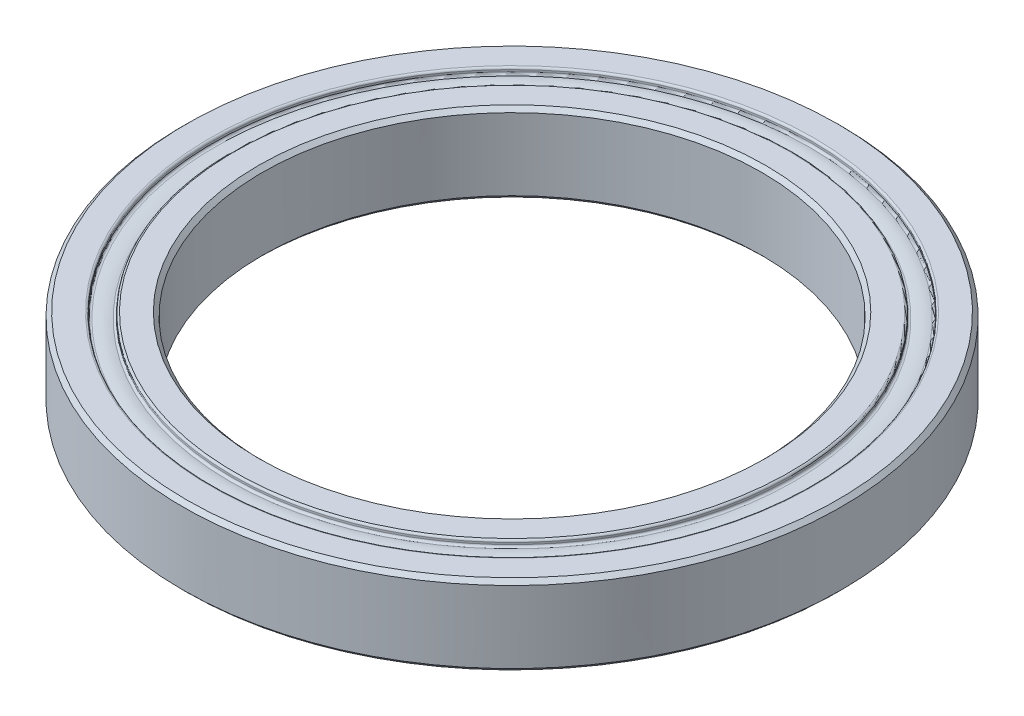
from build123d import *

# Parameters (mm, degrees)
CHAMFER_1_SIZE = 0.4


with BuildPart() as part:
    # 草图1 → 旋转1 (revolve)
    with BuildSketch(Plane.XY, mode=Mode.PRIVATE) as revolve_1_sk:
        with BuildLine():
            Line((-25, 8), (-25, 0))
            Line((-25, 0), (-27.8, 0))
            ThreePointArc((-27.8, 0), (-27.941421356, 0.058578644), (-28, 0.2))
            Line((-28, 0.2), (-28, 0.387521626))
            ThreePointArc((-28, 0.387521626), (-28.074797461, 0.5434842), (-28.243243243, 0.582790728))
            ThreePointArc((-28.243243243, 0.582790728), (-29, 0.5), (-29.756756757, 0.582790728))
            ThreePointArc((-29.756756757, 0.582790728), (-29.925202539, 0.5434842), (-30, 0.387521626))
            Line((-30, 0.387521626), (-30, 0.2))
            ThreePointArc((-30, 0.2), (-30.058578644, 0.058578644), (-30.2, 0))
            Line((-30.2, 0), (-33, 0))
            Line((-33, 0), (-33, 8))
            Line((-33, 8), (-30.2, 8))
            ThreePointArc((-30.2, 8), (-30.058578644, 7.941421356), (-30, 7.8))
            Line((-30, 7.8), (-30, 7.612478374))
            ThreePointArc((-30, 7.612478374), (-29.925202539, 7.4565158), (-29.756756757, 7.417209272))
            ThreePointArc((-29.756756757, 7.417209272), (-29, 7.5), (-28.243243243, 7.417209272))
            ThreePointArc((-28.243243243, 7.417209272), (-28.074797461, 7.4565158), (-28, 7.612478374))
            Line((-28, 7.612478374), (-28, 7.8))
            ThreePointArc((-28, 7.8), (-27.941421356, 7.941421356), (-27.8, 8))
            Line((-27.8, 8), (-25, 8))
        make_face()
    revolve(revolve_1_sk.sketch.rotate(Axis((0, 0, 0), (0, 1, 0)), 270), axis=Axis((0, 0, 0), (0, 1, 0)))

    # 倒角1
    chamfer_1_edges = [part.edges().sort_by_distance(p)[0] for p in [
        (0, 8, 33),
        (0, 0, 33),
        (0, 0, 25),
        (0, 8, 25),
    ]]
    chamfer(chamfer_1_edges, length=CHAMFER_1_SIZE)


solid = part.part
